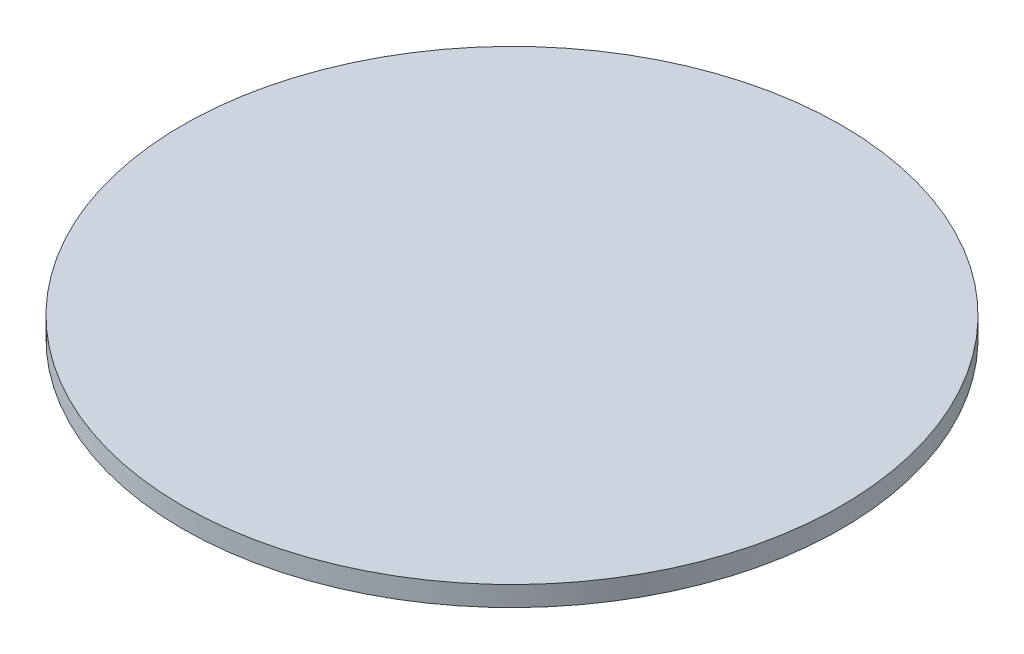
from build123d import *

# Parameters (mm, degrees)
SKETCH1_R           = 16.5
BOSS_EXTRUDE1_DEPTH = 1


with BuildPart() as part:
    # Sketch1 → Boss-Extrude1 (new body)
    with BuildSketch(Plane(origin=(0, 0, 0), x_dir=(1, 0, 0), z_dir=(0, 1, 0))):
        with Locations(Location((0, 0, 0), (0, 0, 270))):
            Circle(SKETCH1_R)
    extrude(amount=BOSS_EXTRUDE1_DEPTH)


solid = part.part
